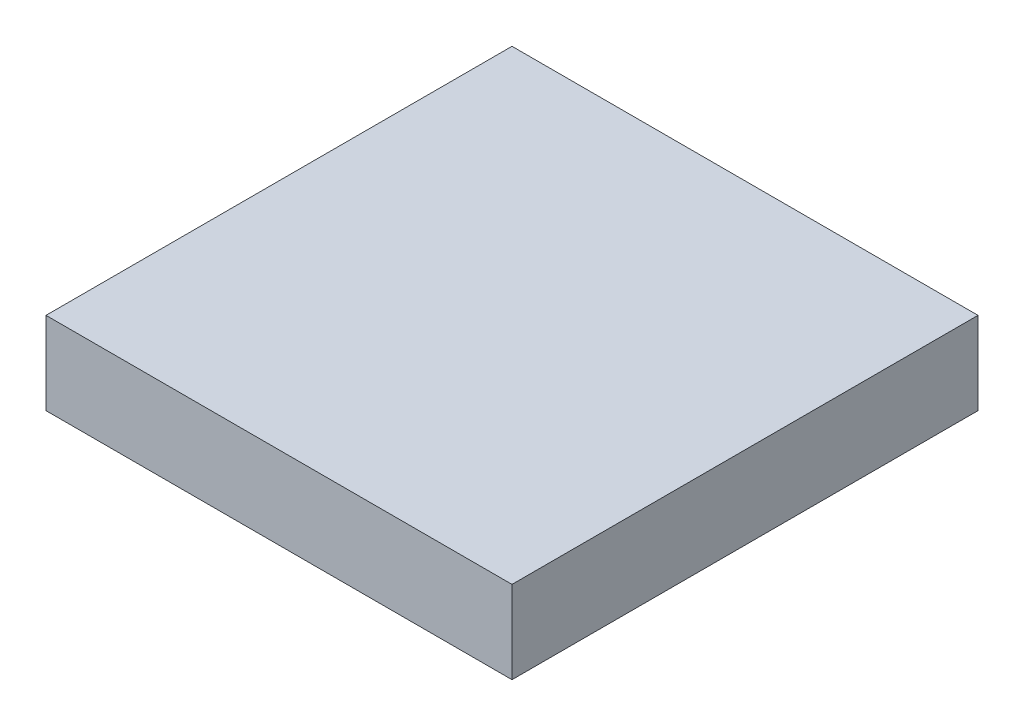
from build123d import *

# Parameters (mm, degrees)
SKETCH1_W           = 25.4
SKETCH1_H           = 25.4
BOSS_EXTRUDE1_DEPTH = 4.5


with BuildPart() as part:
    # Sketch1 → Boss-Extrude1 (new body)
    with BuildSketch(Plane(origin=(0, 0, 0), x_dir=(1, 0, 0), z_dir=(0, 1, 0))):
        Rectangle(SKETCH1_W, SKETCH1_H)
    extrude(amount=BOSS_EXTRUDE1_DEPTH)


solid = part.part
